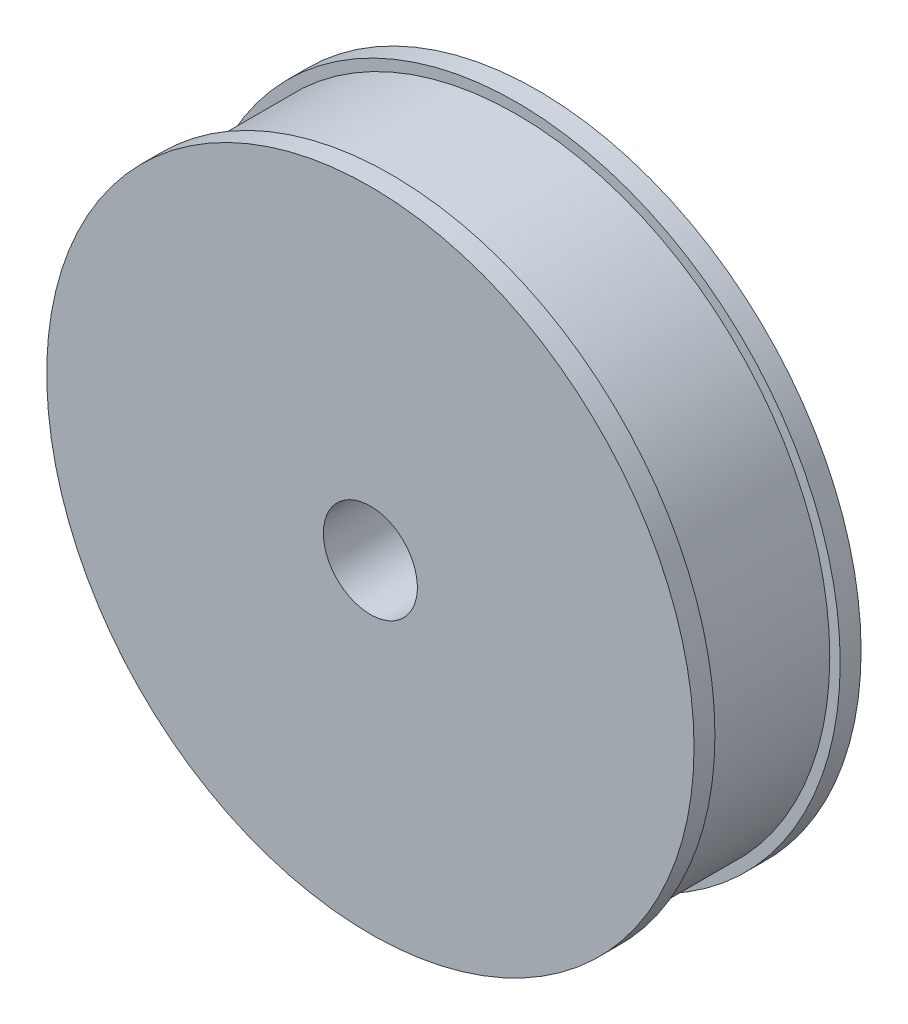
from build123d import *

# Parameters (mm, degrees)
SKETCH_1_R          = 31
EXTRUDE_1_DEPTH     = 2
SKETCH_2_R          = 30
EXTRUDE_2_DEPTH     = 12
SKETCH_3_R          = 31
EXTRUDE_3_DEPTH     = 2
SKETCH_4_R          = 4.5
CUT_EXTRUDE_1_DEPTH = 47.669047558


with BuildPart() as part:
    # 草图1 → 拉伸1 (new body)
    with BuildSketch(Plane.XY):
        Circle(SKETCH_1_R)
    extrude(amount=EXTRUDE_1_DEPTH)

    # 草图2 → 拉伸2 (add)
    with BuildSketch(Plane.XY.offset(2)):
        Circle(SKETCH_2_R)
    extrude(amount=EXTRUDE_2_DEPTH)

    # 草图3 → 拉伸3 (add)
    with BuildSketch(Plane.XY.offset(14)):
        Circle(SKETCH_3_R)
    extrude(amount=EXTRUDE_3_DEPTH)

    # 草图4 → 切除-拉伸1 (cut, through all)
    with BuildSketch(Plane(origin=(0, 0, 0), x_dir=(-1, 0, 0), z_dir=(0, 0, -1))):
        Circle(SKETCH_4_R)
    extrude(amount=-CUT_EXTRUDE_1_DEPTH, mode=Mode.SUBTRACT)


solid = part.part
